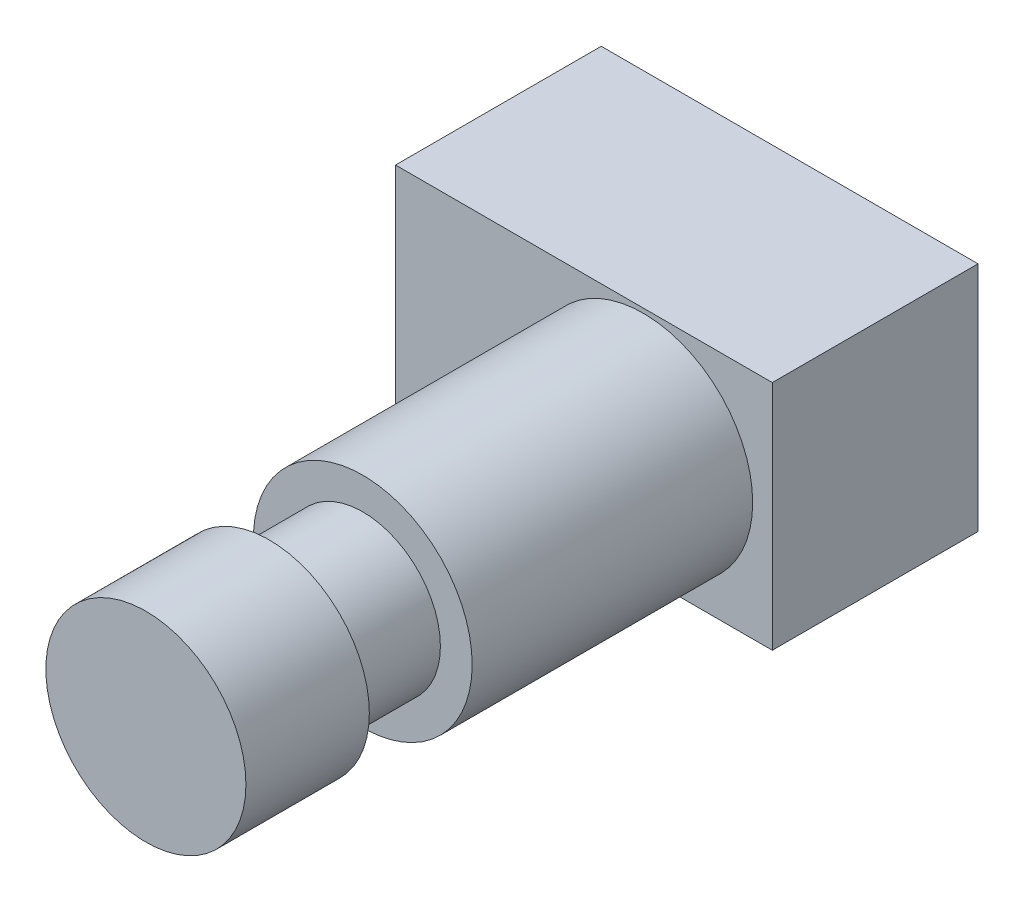
from build123d import *

# Parameters (mm, degrees)
CROQUIS1_R              = 5.85
SALIENTE_EXTRUIR1_DEPTH = 15
CROQUIS2_R              = 4.15
SALIENTE_EXTRUIR2_DEPTH = 5
CROQUIS3_R              = 5.35
SALIENTE_EXTRUIR3_DEPTH = 6.6
CROQUIS4_W              = 20.15
CROQUIS4_H              = 12.4
SALIENTE_EXTRUIR4_DEPTH = 11


with BuildPart() as part:
    # Croquis1 → Saliente-Extruir1 (new body)
    with BuildSketch(Plane.XY):
        Circle(CROQUIS1_R)
    extrude(amount=SALIENTE_EXTRUIR1_DEPTH)

    # Croquis2 → Saliente-Extruir2 (add)
    with BuildSketch(Plane.XY.offset(15)):
        Circle(CROQUIS2_R)
    extrude(amount=SALIENTE_EXTRUIR2_DEPTH)

    # Croquis3 → Saliente-Extruir3 (add)
    with BuildSketch(Plane.XY.offset(20)):
        Circle(CROQUIS3_R)
    extrude(amount=SALIENTE_EXTRUIR3_DEPTH)

    # Croquis4 → Saliente-Extruir4 (add)
    with BuildSketch(Plane(origin=(0, 0, 0), x_dir=(-1, 0, 0), z_dir=(0, 0, -1))):
        with Locations((3.175, -0.113136053)):
            Rectangle(CROQUIS4_W, CROQUIS4_H)
    extrude(amount=SALIENTE_EXTRUIR4_DEPTH)


solid = part.part
